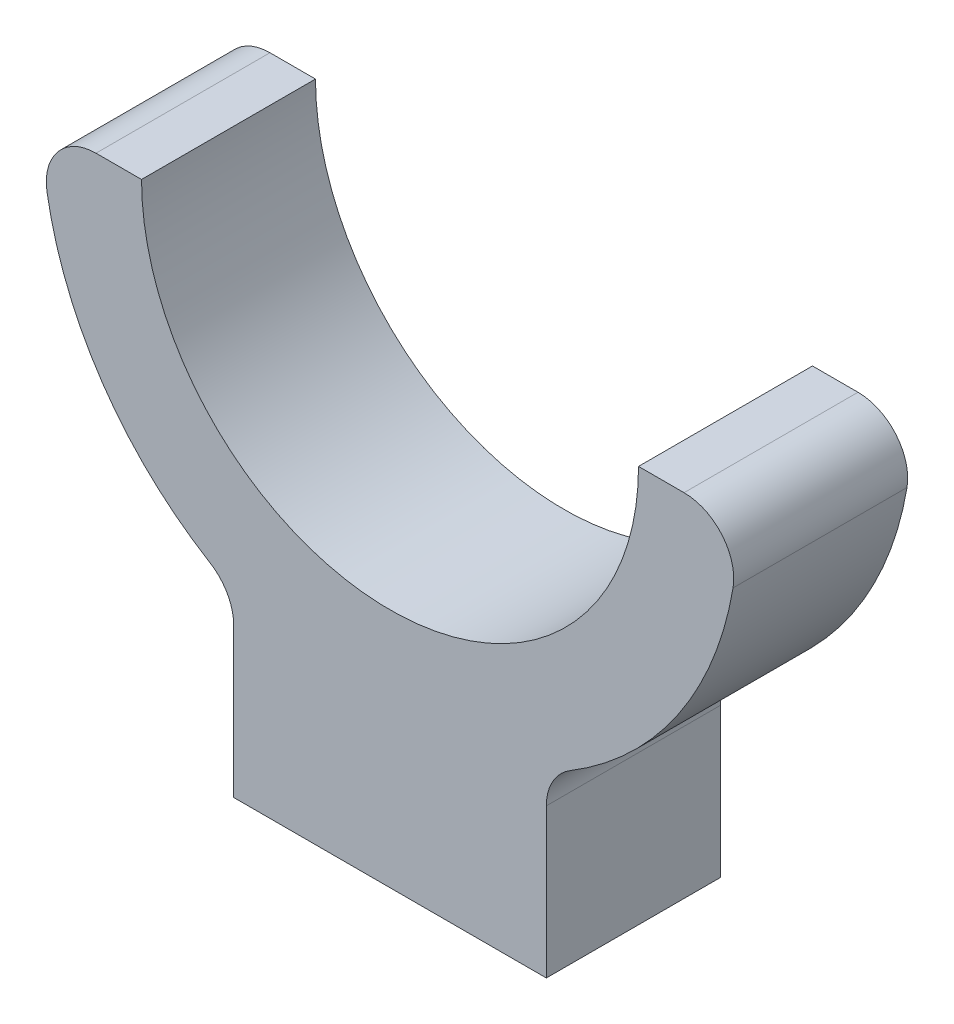
from build123d import *

# Parameters (mm, degrees)
EXTRUDE_1_DEPTH = 8.89


with BuildPart() as part:
    # 草图1 → 凸台-拉伸1 (new body)
    with BuildSketch(Plane.XY):
        with BuildLine():
            Line((-15.026842649, 0), (-12.7, 0))
            ThreePointArc((-12.7, 0), (0, -12.7), (12.7, 0))
            Line((12.7, 0), (15.026842649, 0))
            ThreePointArc((15.026842649, 0), (16.966799693, -0.90043705), (17.531316424, -2.963333333))
            ThreePointArc((17.531316424, -2.963333333), (14.706844565, -9.991852829), (9.213060739, -15.206837667))
            ThreePointArc((9.213060739, -15.206837667), (8.316225051, -16.132532355), (7.989212273, -17.379243047))
            Line((7.989212273, -17.379243047), (7.989212273, -24.999243047))
            Line((7.989212273, -24.999243047), (-7.989212273, -24.999243047))
            Line((-7.989212273, -24.999243047), (-7.989212273, -17.379243047))
            ThreePointArc((-7.989212273, -17.379243047), (-8.316225051, -16.132532355), (-9.213060739, -15.206837667))
            ThreePointArc((-9.213060739, -15.206837667), (-14.706844565, -9.991852829), (-17.531316424, -2.963333333))
            ThreePointArc((-17.531316424, -2.963333333), (-16.966799693, -0.90043705), (-15.026842649, 0))
        make_face()
    extrude(amount=EXTRUDE_1_DEPTH)


solid = part.part
